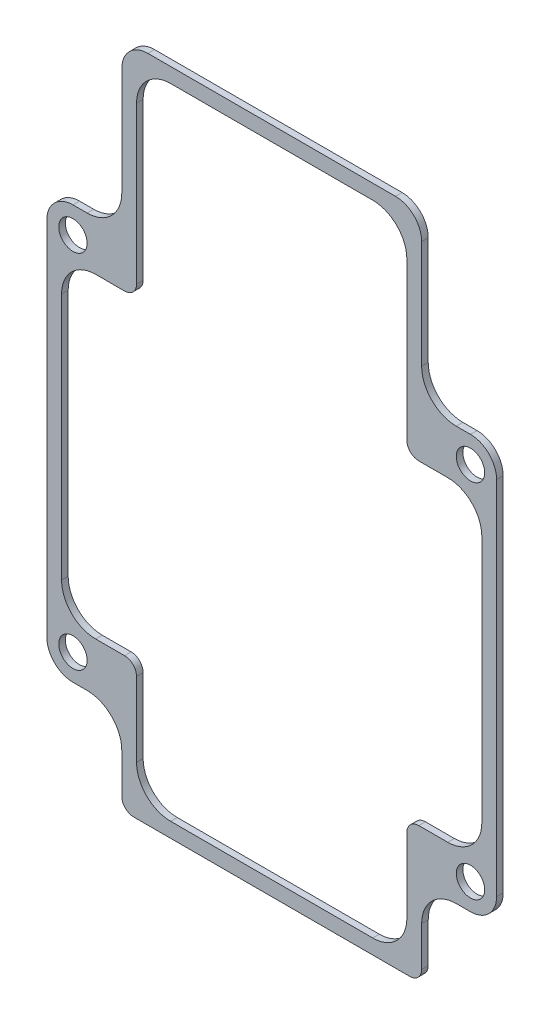
from build123d import *

# Parameters (mm, degrees)
SKETCH1_R           = 1.5875
BOSS_EXTRUDE1_DEPTH = 0.7366


with BuildPart() as part:
    # Sketch1 → Boss-Extrude1 (new body)
    with BuildSketch(Plane.XY):
        with BuildLine():
            Line((-16.764, -26.9875), (-16.764, -31.4325))
            ThreePointArc((-16.764, -31.4325), (-16.373426893, -32.375426893), (-15.4305, -32.766))
            Line((-15.4305, -32.766), (15.4305, -32.766))
            ThreePointArc((15.4305, -32.766), (16.373426893, -32.375426893), (16.764, -31.4325))
            Line((16.764, -31.4325), (16.764, -26.9875))
            ThreePointArc((16.764, -26.9875), (17.898521883, -24.248521883), (20.6375, -23.114))
            Line((20.6375, -23.114), (22.225, -23.114))
            ThreePointArc((22.225, -23.114), (24.290458908, -22.258458908), (25.146, -20.193))
            Line((25.146, -20.193), (25.146, 20.193))
            ThreePointArc((25.146, 20.193), (24.290458908, 22.258458908), (22.225, 23.114))
            Line((22.225, 23.114), (20.6375, 23.114))
            ThreePointArc((20.6375, 23.114), (17.898521883, 24.248521883), (16.764, 26.9875))
            Line((16.764, 26.9875), (16.764, 39.0525))
            ThreePointArc((16.764, 39.0525), (15.908458908, 41.117958908), (13.843, 41.9735))
            Line((13.843, 41.9735), (-13.843, 41.9735))
            ThreePointArc((-13.843, 41.9735), (-15.908458908, 41.117958908), (-16.764, 39.0525))
            Line((-16.764, 39.0525), (-16.764, 26.9875))
            ThreePointArc((-16.764, 26.9875), (-17.898521883, 24.248521883), (-20.6375, 23.114))
            Line((-20.6375, 23.114), (-22.225, 23.114))
            ThreePointArc((-22.225, 23.114), (-24.290458908, 22.258458908), (-25.146, 20.193))
            Line((-25.146, 20.193), (-25.146, -20.193))
            ThreePointArc((-25.146, -20.193), (-24.290458908, -22.258458908), (-22.225, -23.114))
            Line((-22.225, -23.114), (-20.6375, -23.114))
            ThreePointArc((-20.6375, -23.114), (-17.898521883, -24.248521883), (-16.764, -26.9875))
        make_face()
        with Locations((-22.225, 20.193)):
            Circle(SKETCH1_R, mode=Mode.SUBTRACT)
        with Locations((22.225, 20.193)):
            Circle(SKETCH1_R, mode=Mode.SUBTRACT)
        with Locations((22.225, -20.193)):
            Circle(SKETCH1_R, mode=Mode.SUBTRACT)
        with Locations((-22.225, -20.193)):
            Circle(SKETCH1_R, mode=Mode.SUBTRACT)
        with BuildLine():
            Line((15.113, -27.305), (15.113, -18.9865))
            ThreePointArc((15.113, -18.9865), (15.503573107, -18.043573107), (16.4465, -17.653))
            Line((16.4465, -17.653), (19.685, -17.653))
            ThreePointArc((19.685, -17.653), (22.379076836, -16.537076836), (23.495, -13.843))
            Line((23.495, -13.843), (23.495, 13.843))
            ThreePointArc((23.495, 13.843), (22.379076836, 16.537076836), (19.685, 17.653))
            Line((19.685, 17.653), (16.4465, 17.653))
            ThreePointArc((16.4465, 17.653), (15.503573107, 18.043573107), (15.113, 18.9865))
            Line((15.113, 18.9865), (15.113, 36.5125))
            ThreePointArc((15.113, 36.5125), (13.997076836, 39.206576836), (11.303, 40.3225))
            Line((11.303, 40.3225), (-11.303, 40.3225))
            ThreePointArc((-11.303, 40.3225), (-13.997076836, 39.206576836), (-15.113, 36.5125))
            Line((-15.113, 36.5125), (-15.113, 18.9865))
            ThreePointArc((-15.113, 18.9865), (-15.503573107, 18.043573107), (-16.4465, 17.653))
            Line((-16.4465, 17.653), (-19.685, 17.653))
            ThreePointArc((-19.685, 17.653), (-22.379076836, 16.537076836), (-23.495, 13.843))
            Line((-23.495, 13.843), (-23.495, -13.843))
            ThreePointArc((-23.495, -13.843), (-22.379076836, -16.537076836), (-19.685, -17.653))
            Line((-19.685, -17.653), (-16.4465, -17.653))
            ThreePointArc((-16.4465, -17.653), (-15.503573107, -18.043573107), (-15.113, -18.9865))
            Line((-15.113, -18.9865), (-15.113, -27.305))
            ThreePointArc((-15.113, -27.305), (-13.997076836, -29.999076836), (-11.303, -31.115))
            Line((-11.303, -31.115), (11.303, -31.115))
            ThreePointArc((11.303, -31.115), (13.997076836, -29.999076836), (15.113, -27.305))
        make_face(mode=Mode.SUBTRACT)
    extrude(amount=BOSS_EXTRUDE1_DEPTH)


solid = part.part
